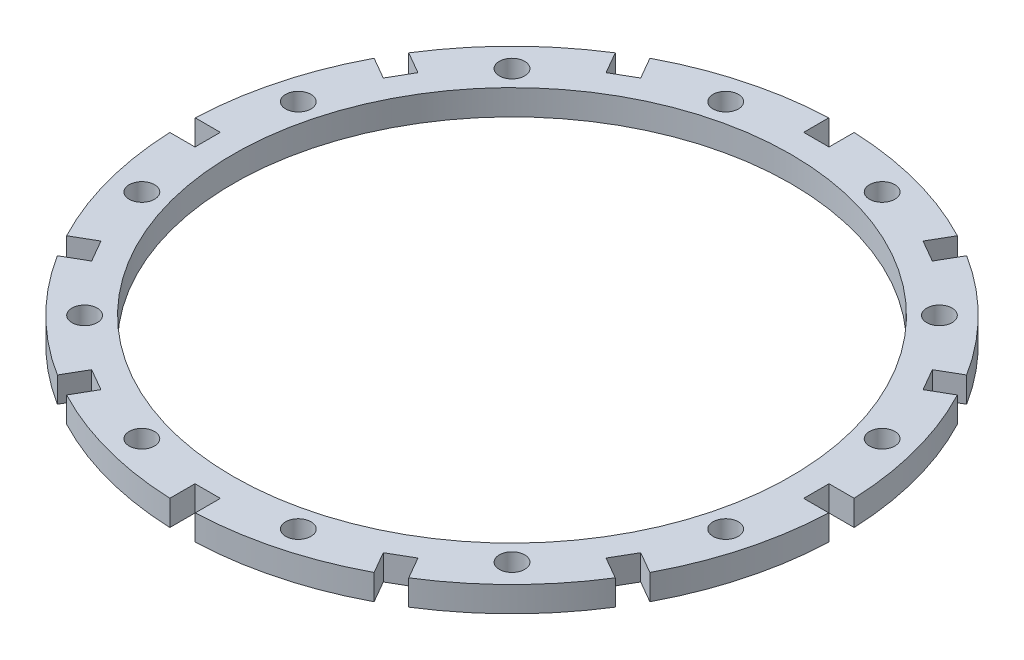
from build123d import *

# Parameters (mm, degrees)
SKETCH1_R           = 141.81
SKETCH1_R_2         = 119.99
BOSS_EXTRUDE1_DEPTH = 10.91
CUT_EXTRUDE1_START  = -10.91
SKETCH2_W           = 21.82
SKETCH2_H           = 10.91
SKETCH2_W_2         = 10.91
SKETCH2_H_2         = 21.82
CUT_EXTRUDE1_DEPTH  = 10.91
SKETCH3_R           = 5.455
CUT_EXTRUDE2_DEPTH  = 10.91


with BuildPart() as part:
    # Sketch1 → Boss-Extrude1 (new body)
    with BuildSketch(Plane(origin=(0, 0, 0), x_dir=(1, 0, 0), z_dir=(0, 1, 0))):
        with Locations(Location((0, 0, 0), (0, 0, 270))):
            Circle(SKETCH1_R)
        with Locations(Location((0, 0, 0), (0, 0, 270))):
            Circle(SKETCH1_R_2, mode=Mode.SUBTRACT)
    extrude(amount=BOSS_EXTRUDE1_DEPTH)

    # Sketch2 → Cut-Extrude1 (cut)
    with BuildSketch(Plane(origin=(0, 10.91, 0), x_dir=(1, 0, 0), z_dir=(0, 1, 0)).offset(CUT_EXTRUDE1_START)):
        with BuildLine():
            Line((-5.455, -130.9), (-5.455, -141.705042518))
            ThreePointArc((-5.455, -141.705042518), (0, -141.81), (5.455, -141.705042518))
            Line((5.455, -141.705042518), (5.455, -130.9))
            Line((5.455, -130.9), (0, -130.9))
            Line((0, -130.9), (-5.455, -130.9))
        make_face()
        Polygon((-71.635831422, -134.986899666), (-60.725831422, -116.090225355), (-70.174168578, -110.635225355), (-81.084168578, -129.531899666), align=None)
        Polygon((-129.531899666, -81.084168578), (-110.635225355, -70.174168578), (-116.090225355, -60.725831422), (-134.986899666, -71.635831422), align=None)
        with Locations((-141.81, 0)):
            Rectangle(SKETCH2_W, SKETCH2_H)
        Polygon((-134.986899666, 71.635831422), (-116.090225355, 60.725831422), (-110.635225355, 70.174168578), (-129.531899666, 81.084168578), align=None)
        Polygon((-81.084168578, 129.531899666), (-70.174168578, 110.635225355), (-60.725831422, 116.090225355), (-71.635831422, 134.986899666), align=None)
        with Locations((0, 141.81)):
            Rectangle(SKETCH2_W_2, SKETCH2_H_2)
        Polygon((71.635831422, 134.986899666), (60.725831422, 116.090225355), (70.174168578, 110.635225355), (81.084168578, 129.531899666), align=None)
        Polygon((129.531899666, 81.084168578), (110.635225355, 70.174168578), (116.090225355, 60.725831422), (134.986899666, 71.635831422), align=None)
        with Locations((141.81, 0)):
            Rectangle(SKETCH2_W, SKETCH2_H)
        Polygon((134.986899666, -71.635831422), (116.090225355, -60.725831422), (110.635225355, -70.174168578), (129.531899666, -81.084168578), align=None)
        Polygon((81.084168578, -129.531899666), (70.174168578, -110.635225355), (60.725831422, -116.090225355), (71.635831422, -134.986899666), align=None)
    extrude(amount=CUT_EXTRUDE1_DEPTH, mode=Mode.SUBTRACT)

    # Sketch3 → Cut-Extrude2 (cut)
    with BuildSketch(Plane(origin=(0, 10.91, 0), x_dir=(1, 0, 0), z_dir=(0, 1, 0))):
        with Locations(Location((-33.646658285, -125.571038224, 0), (0, 0, 270))):
            Circle(SKETCH3_R)
        with Locations(Location((-91.924379939, -91.924379939, 0), (0, 0, 270))):
            Circle(SKETCH3_R)
        with Locations(Location((-125.571038224, -33.646658285, 0), (0, 0, 270))):
            Circle(SKETCH3_R)
        with Locations(Location((-125.571038224, 33.646658285, 0), (0, 0, 270))):
            Circle(SKETCH3_R)
        with Locations(Location((-91.924379939, 91.924379939, 0), (0, 0, 270))):
            Circle(SKETCH3_R)
        with Locations(Location((-33.646658285, 125.571038224, 0), (0, 0, 270))):
            Circle(SKETCH3_R)
        with Locations(Location((33.646658285, 125.571038224, 0), (0, 0, 270))):
            Circle(SKETCH3_R)
        with Locations(Location((91.924379939, 91.924379939, 0), (0, 0, 270))):
            Circle(SKETCH3_R)
        with Locations(Location((125.571038224, 33.646658285, 0), (0, 0, 270))):
            Circle(SKETCH3_R)
        with Locations(Location((125.571038224, -33.646658285, 0), (0, 0, 270))):
            Circle(SKETCH3_R)
        with Locations(Location((91.924379939, -91.924379939, 0), (0, 0, 270))):
            Circle(SKETCH3_R)
        with Locations(Location((33.646658285, -125.571038224, 0), (0, 0, 270))):
            Circle(SKETCH3_R)
    extrude(amount=-CUT_EXTRUDE2_DEPTH, mode=Mode.SUBTRACT)


solid = part.part
